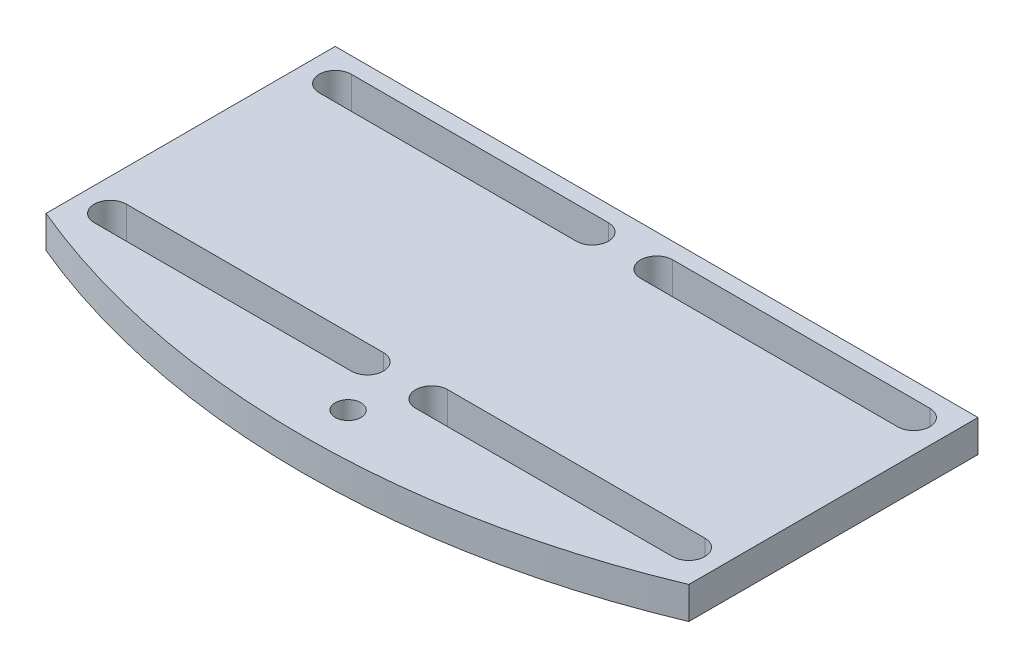
from build123d import *

# Parameters (mm, degrees)
BOSS_EXTRUDE1_DEPTH = 5
CUT_EXTRUDE1_REACH  = 72.887
CUT_EXTRUDE2_REACH  = 72.887
SKETCH3_R           = 2


with BuildPart() as part:
    # Sketch1 → Boss-Extrude1 (new body)
    with BuildSketch(Plane(origin=(0, 0, 0), x_dir=(1, 0, 0), z_dir=(0, 1, 0))):
        with BuildLine():
            Line((50, -40), (50, 5))
            Line((50, 5), (-50, 5))
            Line((-50, 5), (-50, -40))
            ThreePointArc((-50, -40), (0, -50), (50, -40))
        make_face()
    extrude(amount=BOSS_EXTRUDE1_DEPTH)

    # Sketch2 → Cut-Extrude1 (cut, up to next)
    with BuildSketch(Plane(origin=(0, 5, 0), x_dir=(1, 0, 0), z_dir=(0, 1, 0)), mode=Mode.PRIVATE) as cut_extrude1_sk1:
        with BuildLine():
            Line((-45, -32.5), (-5, -32.5))
            ThreePointArc((-5, -32.5), (-2.5, -35), (-5, -37.5))
            Line((-5, -37.5), (-45, -37.5))
            ThreePointArc((-45, -37.5), (-47.5, -35), (-45, -32.5))
        make_face()
    cut_extrude1_tool1 = extrude(cut_extrude1_sk1.sketch, amount=-CUT_EXTRUDE1_REACH, mode=Mode.PRIVATE) & part.part
    # Sketch2 → Cut-Extrude1 (cut, up to next)
    with BuildSketch(Plane(origin=(0, 5, 0), x_dir=(1, 0, 0), z_dir=(0, 1, 0)), mode=Mode.PRIVATE) as cut_extrude1_sk2:
        with BuildLine():
            Line((-45, 2.5), (-5, 2.5))
            ThreePointArc((-5, 2.5), (-2.5, 0), (-5, -2.5))
            Line((-5, -2.5), (-45, -2.5))
            ThreePointArc((-45, -2.5), (-47.5, 0), (-45, 2.5))
        make_face()
    cut_extrude1_tool2 = extrude(cut_extrude1_sk2.sketch, amount=-CUT_EXTRUDE1_REACH, mode=Mode.PRIVATE) & part.part
    cut_extrude1_1 = cut_extrude1_tool1.solids().sort_by_distance((-25, 5, 35))[0]
    add(cut_extrude1_1, mode=Mode.SUBTRACT)
    cut_extrude1_2 = cut_extrude1_tool2.solids().sort_by_distance((-25, 5, 0))[0]
    add(cut_extrude1_2, mode=Mode.SUBTRACT)
    cut_extrude1 = cut_extrude1_1 + cut_extrude1_2  # Cut-Extrude1 as one shape, for the pattern or mirror that repeats it

    # Mirror1: Cut-Extrude1 across plane
    add(cut_extrude1.mirror(Plane(origin=(0, 0, 0), x_dir=(0, 0, 1), z_dir=(1, 0, 0))), mode=Mode.SUBTRACT)

    # Sketch3 → Cut-Extrude2 (cut, up to next)
    with BuildSketch(Plane(origin=(0, 5, 0), x_dir=(1, 0, 0), z_dir=(0, 1, 0)), mode=Mode.PRIVATE) as cut_extrude2_sk1:
        with Locations(Location((0, -43, 0), (0, 0, 270))):
            Circle(SKETCH3_R)
    cut_extrude2_tool1 = extrude(cut_extrude2_sk1.sketch, amount=-CUT_EXTRUDE2_REACH, mode=Mode.PRIVATE) & part.part
    add(cut_extrude2_tool1.solids().sort_by_distance((0, 5, 43))[0], mode=Mode.SUBTRACT)


solid = part.part
